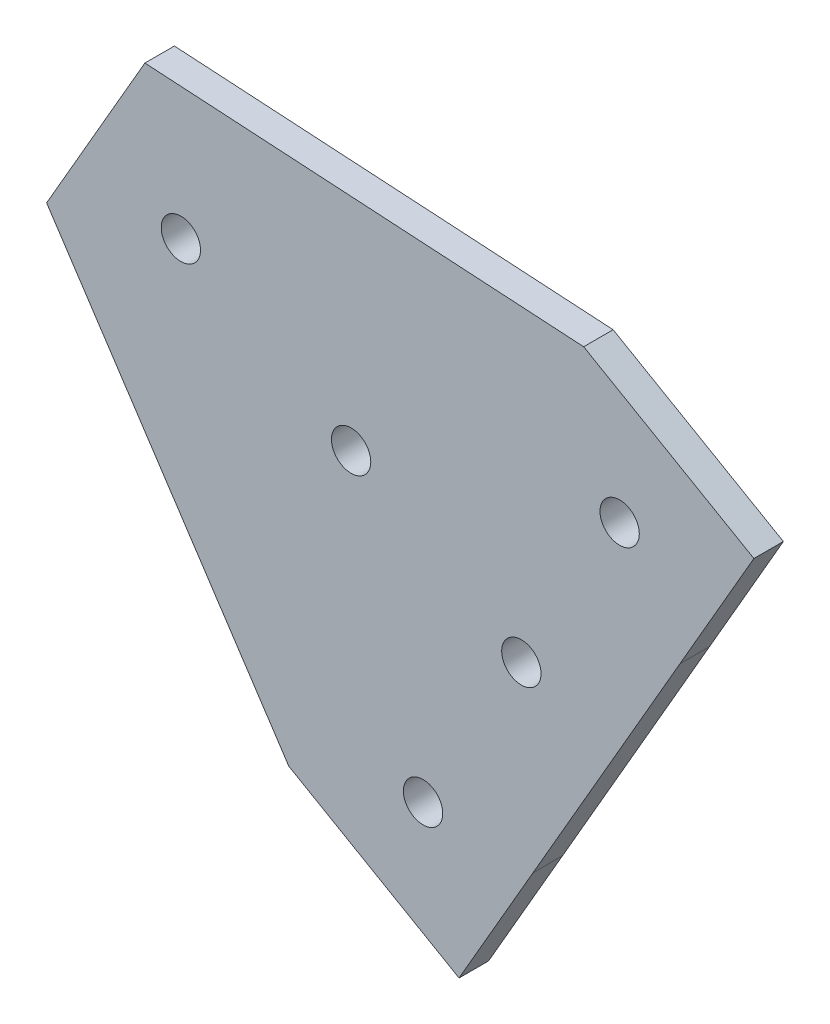
from build123d import *

# Parameters (mm, degrees)
SKETCH_1_R      = 2
EXTRUDE_1_DEPTH = 3


with BuildPart() as part:
    # 草图1 → 凸台-拉伸1 (new body)
    with BuildSketch(Plane.XY):
        with BuildLine():
            Line((-23.117741092, -59.787495014), (-8.210797554, -33.967911422))
            ThreePointArc((-8.210797554, -33.967911422), (-8.188096942, -33.927293779), (-8.165019323, -33.886889148))
            Line((-8.165019323, -33.886889148), (-0.665019323, -20.896508091))
            Line((-0.665019323, -20.896508091), (-17.985527399, -10.896508091))
            Line((-17.985527399, -10.896508091), (-62.62654355, -8.217016167))
            Line((-62.62654355, -8.217016167), (-72.62654355, -25.537524243))
            Line((-72.62654355, -25.537524243), (-47.985527399, -62.858032318))
            Line((-47.985527399, -62.858032318), (-30.665019323, -72.858032318))
            Line((-30.665019323, -72.858032318), (-23.165019323, -59.867651262))
            ThreePointArc((-23.165019323, -59.867651262), (-23.141566696, -59.827463142), (-23.117741092, -59.787495014))
        make_face()
        with Locations((-58.966289512, -21.877270205)):
            Circle(SKETCH_1_R, mode=Mode.SUBTRACT)
        with Locations((-41.645781437, -31.877270205)):
            Circle(SKETCH_1_R, mode=Mode.SUBTRACT)
        with Locations((-24.325273361, -41.877270205)):
            Circle(SKETCH_1_R, mode=Mode.SUBTRACT)
        with Locations((-14.325273361, -24.556762129)):
            Circle(SKETCH_1_R, mode=Mode.SUBTRACT)
        with Locations((-34.325273361, -59.197778281)):
            Circle(SKETCH_1_R, mode=Mode.SUBTRACT)
    extrude(amount=EXTRUDE_1_DEPTH)


solid = part.part
